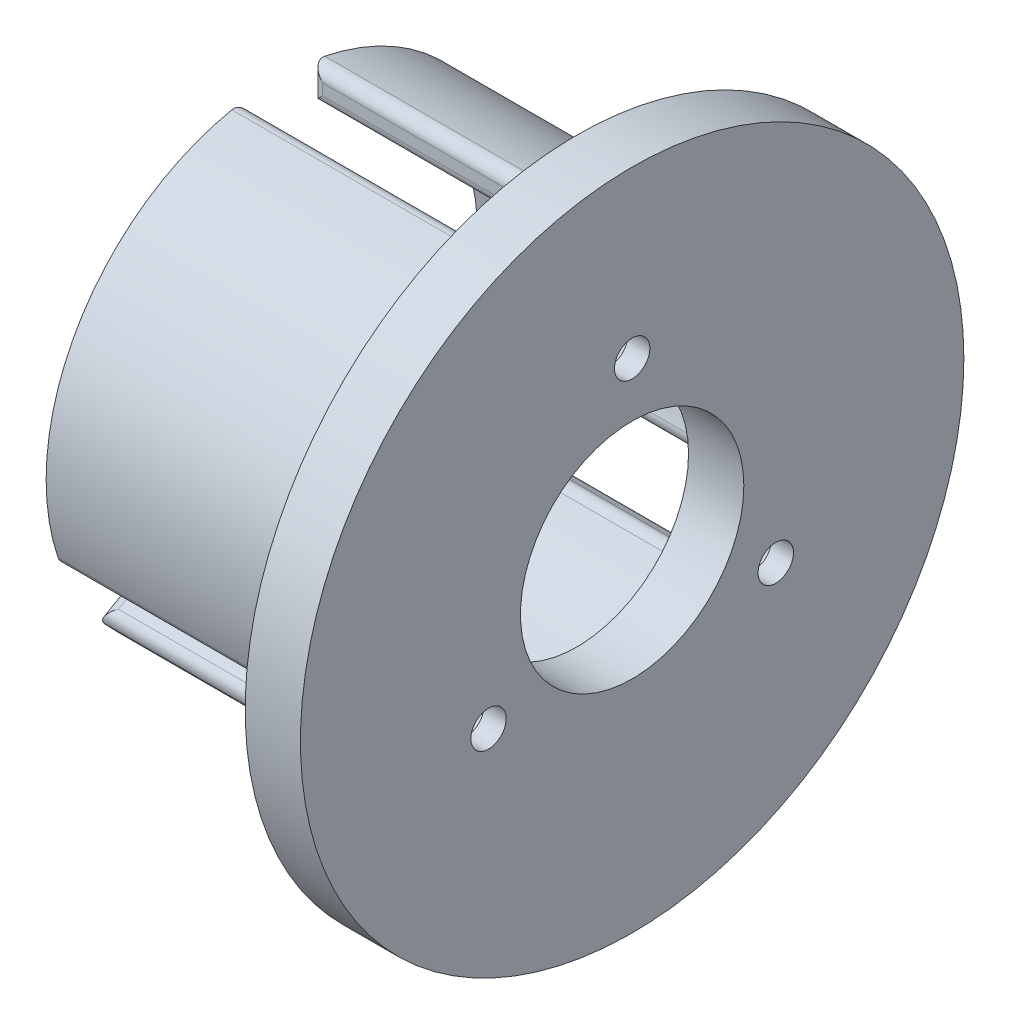
from build123d import *

# Parameters (mm, degrees)
SKETCH_1_R          = 30
SKETCH_1_R_2        = 10.1
EXTRUDE_1_DEPTH     = 5
EXTRUDE_2_DEPTH     = 27
SKETCH_3_R          = 3.1
CUT_EXTRUDE_1_DEPTH = 3
SKETCH_4_R          = 1.6
CUT_EXTRUDE_2_DEPTH = 52.961524227
FILLET_1_R          = 1


with BuildPart() as part:
    # 草图1 → 凸台-拉伸1 (new body)
    with BuildSketch(Plane(origin=(0, 0, 0), x_dir=(0, 0, -1), z_dir=(1, 0, 0))):
        Circle(SKETCH_1_R)
        Circle(SKETCH_1_R_2, mode=Mode.SUBTRACT)
    extrude(amount=EXTRUDE_1_DEPTH)

    # 草图2 → 凸台-拉伸2 (add)
    with BuildSketch(Plane.ZY):
        with BuildLine():
            Line((-3, 20.784609691), (-3, 17.748239349))
            ThreePointArc((-3, 17.748239349), (-15.588457268, 9), (-16.870426149, -6.276043463))
            Line((-16.870426149, -6.276043463), (-19.5, -7.794228634))
            ThreePointArc((-19.5, -7.794228634), (-18.186533479, 10.5), (-3, 20.784609691))
        make_face()
        with BuildLine():
            Line((3, 20.784609691), (3, 17.748239349))
            ThreePointArc((3, 17.748239349), (15.588457268, 9), (16.870426149, -6.276043463))
            Line((16.870426149, -6.276043463), (19.5, -7.794228634))
            ThreePointArc((19.5, -7.794228634), (18.186533479, 10.5), (3, 20.784609691))
        make_face()
        with BuildLine():
            Line((16.5, -12.990381057), (13.870426149, -11.472195886))
            ThreePointArc((13.870426149, -11.472195886), (0, -18), (-13.870426149, -11.472195886))
            Line((-13.870426149, -11.472195886), (-16.5, -12.990381057))
            ThreePointArc((-16.5, -12.990381057), (0, -21), (16.5, -12.990381057))
        make_face()
    extrude(amount=EXTRUDE_2_DEPTH)

    # 草图3 → 切除-拉伸1 (cut)
    with BuildSketch(Plane.ZY):
        with Locations((0, 15)):
            Circle(SKETCH_3_R)
        with Locations((12.990381057, -7.5)):
            Circle(SKETCH_3_R)
        with Locations((-12.990381057, -7.5)):
            Circle(SKETCH_3_R)
    extrude(amount=-CUT_EXTRUDE_1_DEPTH, mode=Mode.SUBTRACT)

    # 草图4 → 切除-拉伸2 (cut, through all)
    with BuildSketch(Plane.ZY.offset(-3)):
        with Locations((0, 15)):
            Circle(SKETCH_4_R)
        with Locations((12.990381057, -7.5)):
            Circle(SKETCH_4_R)
        with Locations((-12.990381057, -7.5)):
            Circle(SKETCH_4_R)
    extrude(amount=-CUT_EXTRUDE_2_DEPTH, mode=Mode.SUBTRACT)

    # 圆角1
    fillet_1_edges = [part.edges().sort_by_distance(p)[0] for p in [
        (0, 10.5, -18.186533479),
        (-13.5, 20.784609691, -3),
        (0, -7.035136049, -18.185213074),
        (-13.5, -7.794228634, -19.5),
        (0, 9, -15.588457268),
        (-13.5, -6.276043463, -16.870426149),
        (0, 19.26642452, -3),
        (-13.5, 17.748239349, -3),
        (-27, -7.035136049, -18.185213074),
        (-27, 19.26642452, -3),
        (0, -21, 0),
        (-13.5, -12.990381057, -16.5),
        (0, -12.231288471, 15.185213074),
        (-13.5, -12.990381057, 16.5),
        (0, -18, 0),
        (-13.5, -11.472195886, 13.870426149),
        (0, -12.231288471, -15.185213074),
        (-13.5, -11.472195886, -13.870426149),
        (-27, -12.231288471, 15.185213074),
        (-27, -12.231288471, -15.185213074),
        (0, 10.5, 18.186533479),
        (-13.5, -7.794228634, 19.5),
        (0, 19.26642452, 3),
        (-13.5, 20.784609691, 3),
        (0, 9, 15.588457268),
        (-13.5, 17.748239349, 3),
        (0, -7.035136049, 18.185213074),
        (-13.5, -6.276043463, 16.870426149),
        (-27, 19.26642452, 3),
        (-27, -7.035136049, 18.185213074),
    ]]
    fillet(fillet_1_edges, radius=FILLET_1_R)


solid = part.part
